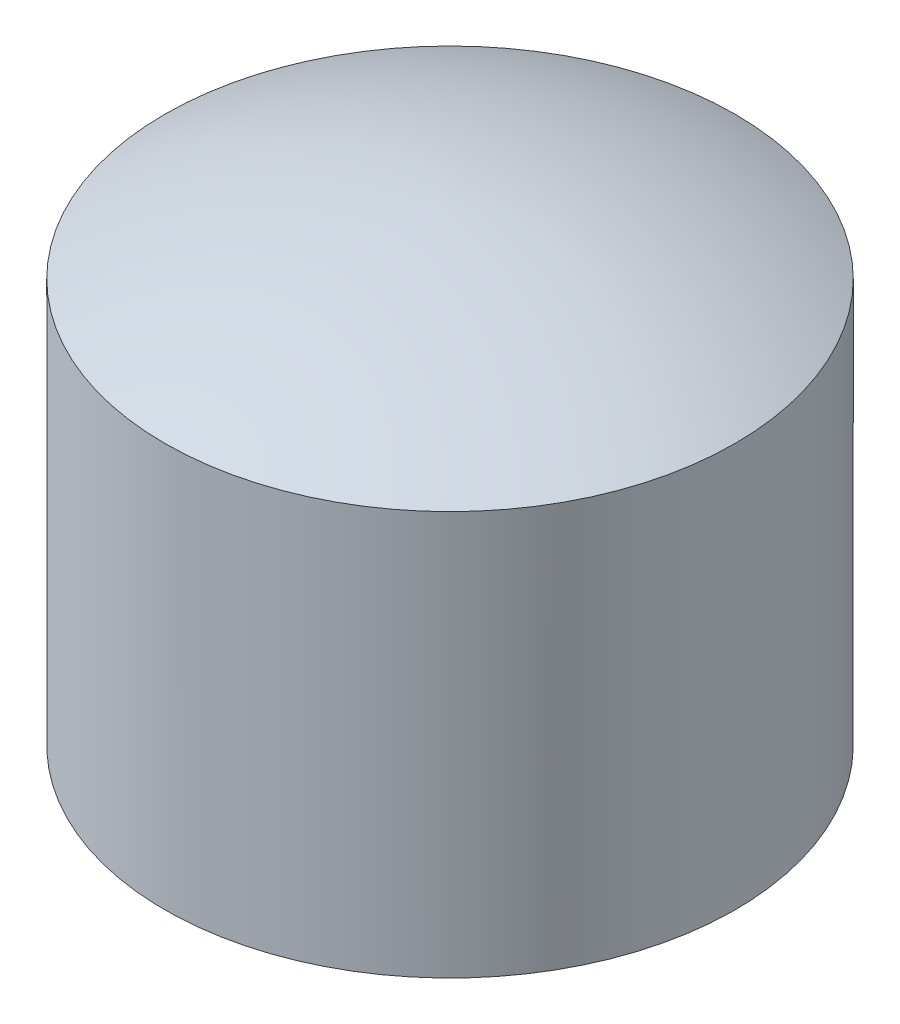
from build123d import *

# Parameters (mm, degrees)
IZIM1_R                     = 6
IZIM1_R_2                   = 4
Y_KSEKLIK_EKSTR_ZYON1_DEPTH = 4.5
BOSS_EXTRUDE1_START         = 4
SKETCH1_R                   = 6
SKETCH1_R_2                 = 4
BOSS_EXTRUDE1_DEPTH         = 4


with BuildPart() as part:
    # Çizim1 → Yükseklik-Ekstrüzyon1 (new body)
    with BuildSketch(Plane(origin=(0, 0, 0), x_dir=(1, 0, 0), z_dir=(0, 1, 0))):
        with Locations(Location((0, 0, 0), (0, 0, 270))):
            Circle(IZIM1_R)
        with Locations(Location((0, 0, 0), (0, 0, 270))):
            Circle(IZIM1_R_2, mode=Mode.SUBTRACT)
    extrude(amount=Y_KSEKLIK_EKSTR_ZYON1_DEPTH)

    # Çizim2 → Döndür1 (revolve)
    with BuildSketch(Plane(origin=(0, 0, 0), x_dir=(0, 0, -1), z_dir=(1, 0, 0))):
        with BuildLine():
            Line((0, 4.5), (0, 6.005722605))
            ThreePointArc((0, 6.005722605), (3.083863381, 5.587039913), (6, 4.5))
            Line((6, 4.5), (0, 4.5))
        make_face()
    revolve(axis=Axis((0, 4.5, 0), (0, 1, 0)))

    # Sketch1 → Boss-Extrude1 (add)
    with BuildSketch(Plane.XZ.offset(BOSS_EXTRUDE1_START)):
        with Locations(Location((0, 0, 0), (0, 0, 270))):
            Circle(SKETCH1_R)
        with Locations(Location((0, 0, 0), (0, 0, 270))):
            Circle(SKETCH1_R_2, mode=Mode.SUBTRACT)
    extrude(amount=-BOSS_EXTRUDE1_DEPTH)


solid = part.part
